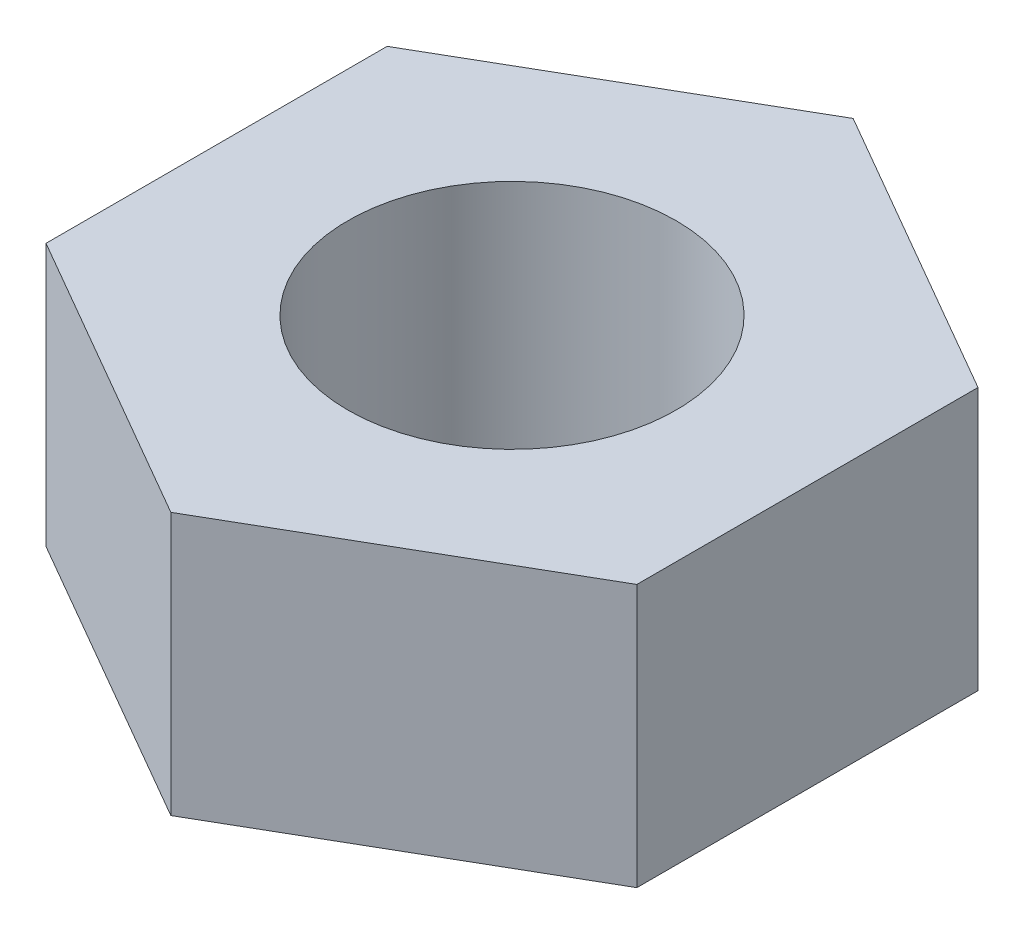
from build123d import *

# Parameters (mm, degrees)
SKETCH1_R           = 1.5
BOSS_EXTRUDE1_DEPTH = 2.4


with BuildPart() as part:
    # Sketch1 → Boss-Extrude1 (new body)
    with BuildSketch(Plane(origin=(0, 0, 0), x_dir=(1, 0, 0), z_dir=(0, 1, 0))):
        Polygon((0, 3.117691454), (-2.7, 1.558845727), (-2.7, -1.558845727), (0, -3.117691454), (2.7, -1.558845727), (2.7, 1.558845727), align=None)
        with Locations(Location((0, 0, 0), (0, 0, 270))):
            Circle(SKETCH1_R, mode=Mode.SUBTRACT)
    extrude(amount=BOSS_EXTRUDE1_DEPTH)


solid = part.part
